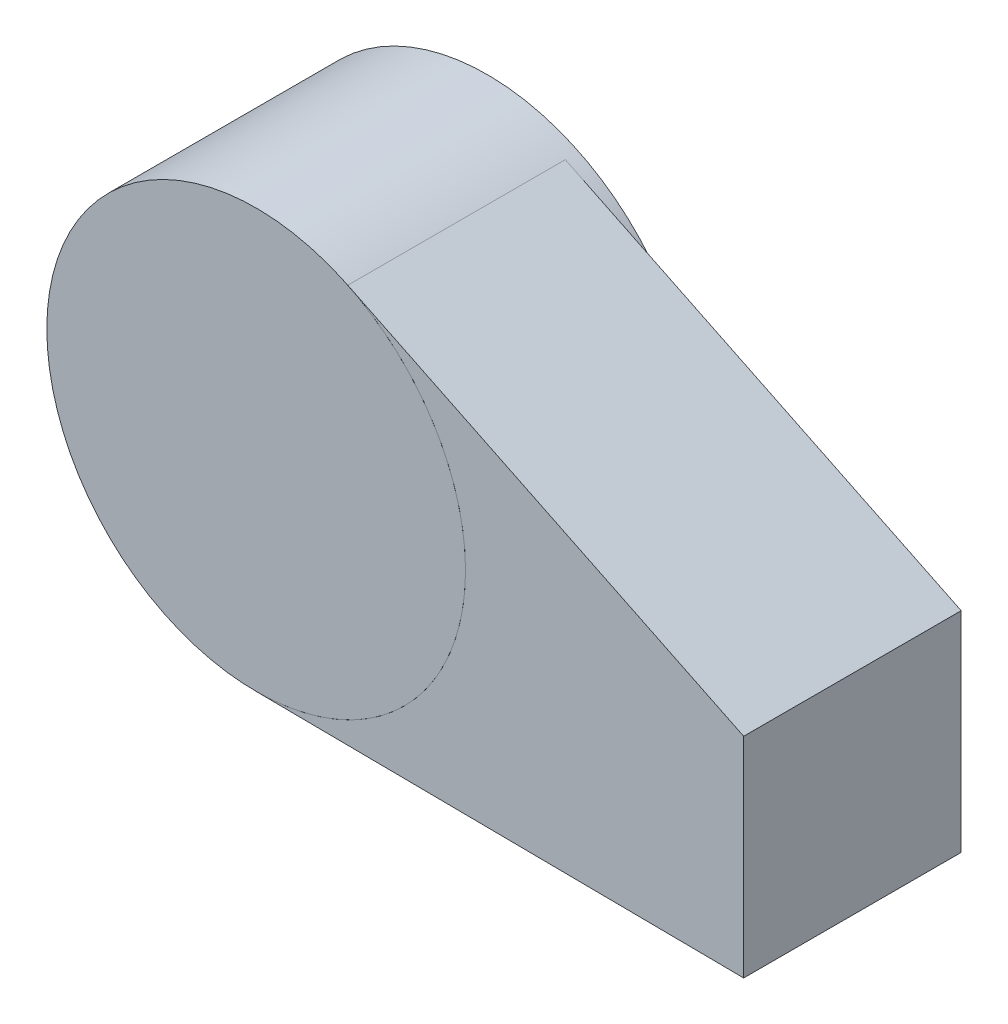
from build123d import *

# Parameters (mm, degrees)
BOSS_EXTRUDE3_DEPTH      = 80
BOSS_EXTRUDE4_DEPTH      = 5
BOSS_EXTRUDE4_DEPTH_BACK = 80
SKETCH4_R                = 77


with BuildPart() as part:
    # Sketch2 → Boss-Extrude3 (new body)
    with BuildSketch(Plane.XY):
        with BuildLine():
            Line((179.301743725, -78.629188464), (179.301743725, -1.629188422))
            Line((179.301743725, -1.629188422), (33.69625772, 69.235556007))
            ThreePointArc((33.69625772, 69.235556007), (65.282508547, 40.831287976), (77, 0))
            ThreePointArc((77, 0), (54.199789053, -54.693535876), (-0.698256275, -76.996833949))
            Line((-0.698256275, -76.996833949), (179.301743725, -78.629188464))
        make_face()
    extrude(amount=BOSS_EXTRUDE3_DEPTH)


with BuildPart() as body_2:
    # Sketch4 → Boss-Extrude4 (new, two sides: drawn at the far end of the back side and taken through both)
    with BuildSketch(Plane(origin=(0, 0, 0), x_dir=(-1, 0, 0), z_dir=(0, 0, -1)).offset(-BOSS_EXTRUDE4_DEPTH_BACK)):
        Circle(SKETCH4_R)
    extrude(amount=BOSS_EXTRUDE4_DEPTH + BOSS_EXTRUDE4_DEPTH_BACK)


solid = Compound([part.part, body_2.part])
